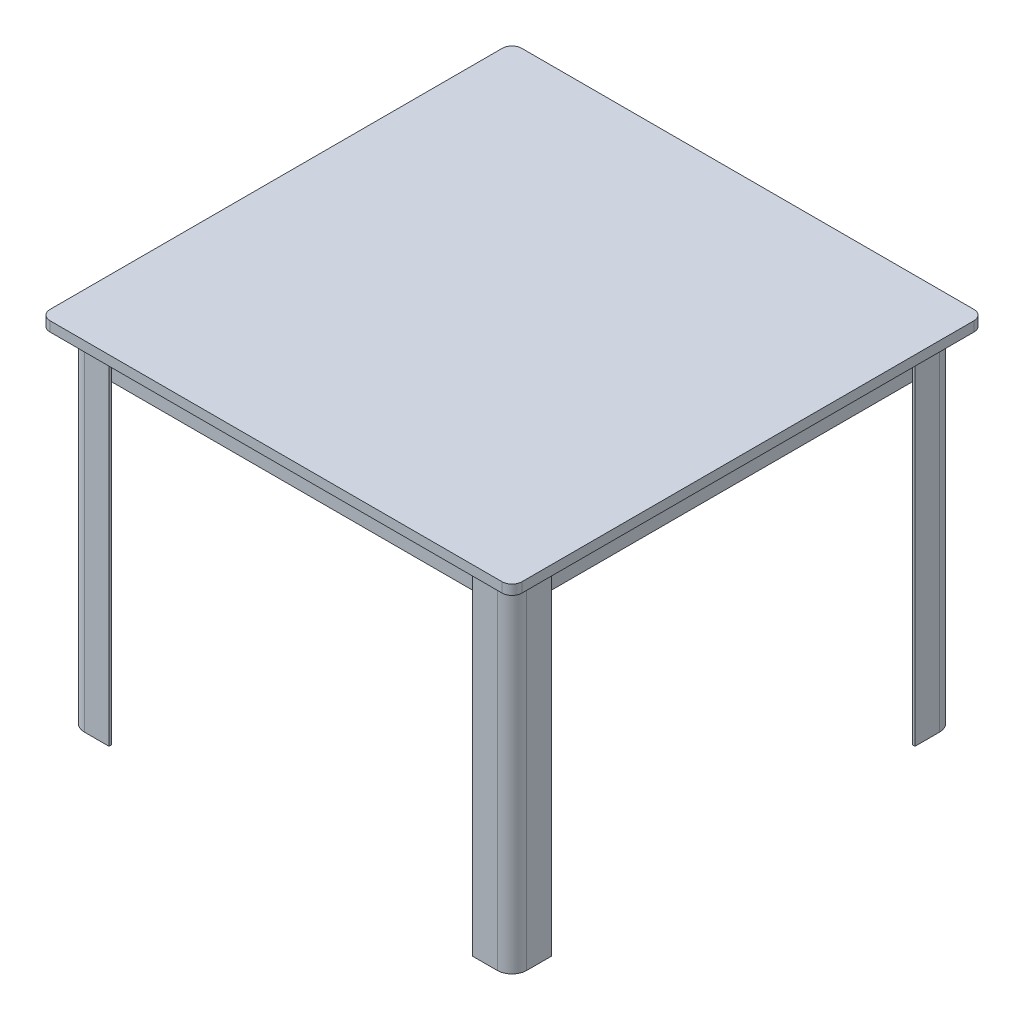
from build123d import *

# Parameters (mm, degrees)
SKETCH1_W         = 1219.2
SKETCH1_H         = 1219.2
EXTRUDE1_DEPTH    = 25.4
FILLET1_R         = 25.4
EXTRUDE2_DEPTH    = 889
SKETCH3_W         = 6.35
SKETCH3_H         = 1066.8
EXTRUDE3_DEPTH    = 76.2
CIRPATTERN1_COUNT = 4


with BuildPart() as part:
    # Sketch1 → Extrude1 (new body)
    with BuildSketch(Plane(origin=(0, 0, 0), x_dir=(1, 0, 0), z_dir=(0, 1, 0))):
        Rectangle(SKETCH1_W, SKETCH1_H)
    extrude(amount=-EXTRUDE1_DEPTH)

    # Fillet1
    fillet1_edges = [part.edges().sort_by_distance(p)[0] for p in [
        (-609.6, -12.7, 609.6),
        (609.6, -12.7, -609.6),
        (-609.6, -12.7, -609.6),
        (609.6, -12.7, 609.6),
    ]]
    fillet(fillet1_edges, radius=FILLET1_R)

    # Sketch2 → Extrude2 (add)
    with BuildSketch(Plane.XZ.offset(25.4)):
        with BuildLine():
            Line((-469.9, 571.5), (-469.9, 565.15))
            Line((-469.9, 565.15), (-533.4, 565.15))
            ThreePointArc((-533.4, 565.15), (-555.850640303, 555.850640303), (-565.15, 533.4))
            Line((-565.15, 533.4), (-565.15, 469.9))
            Line((-565.15, 469.9), (-571.5, 469.9))
            Line((-571.5, 469.9), (-571.5, 533.4))
            ThreePointArc((-571.5, 533.4), (-560.340768363, 560.340768363), (-533.4, 571.5))
            Line((-533.4, 571.5), (-469.9, 571.5))
        make_face()
    extrude2 = extrude(amount=EXTRUDE2_DEPTH)

    # Sketch3 → Extrude3 (add)
    with BuildSketch(Plane.XZ.offset(25.4)):
        with Locations((-561.975, 0)):
            Rectangle(SKETCH3_W, SKETCH3_H)
    extrude3 = extrude(amount=EXTRUDE3_DEPTH)

    # CirPattern1: Extrude2, Extrude3 ×4 about axis
    cirpattern1_axis = Axis((0, 0, 0), (0, -1, 0))
    add([extrude2.rotate(cirpattern1_axis, i * 360 / CIRPATTERN1_COUNT) for i in range(1, CIRPATTERN1_COUNT)])
    add([extrude3.rotate(cirpattern1_axis, i * 360 / CIRPATTERN1_COUNT) for i in range(1, CIRPATTERN1_COUNT)])


solid = part.part
